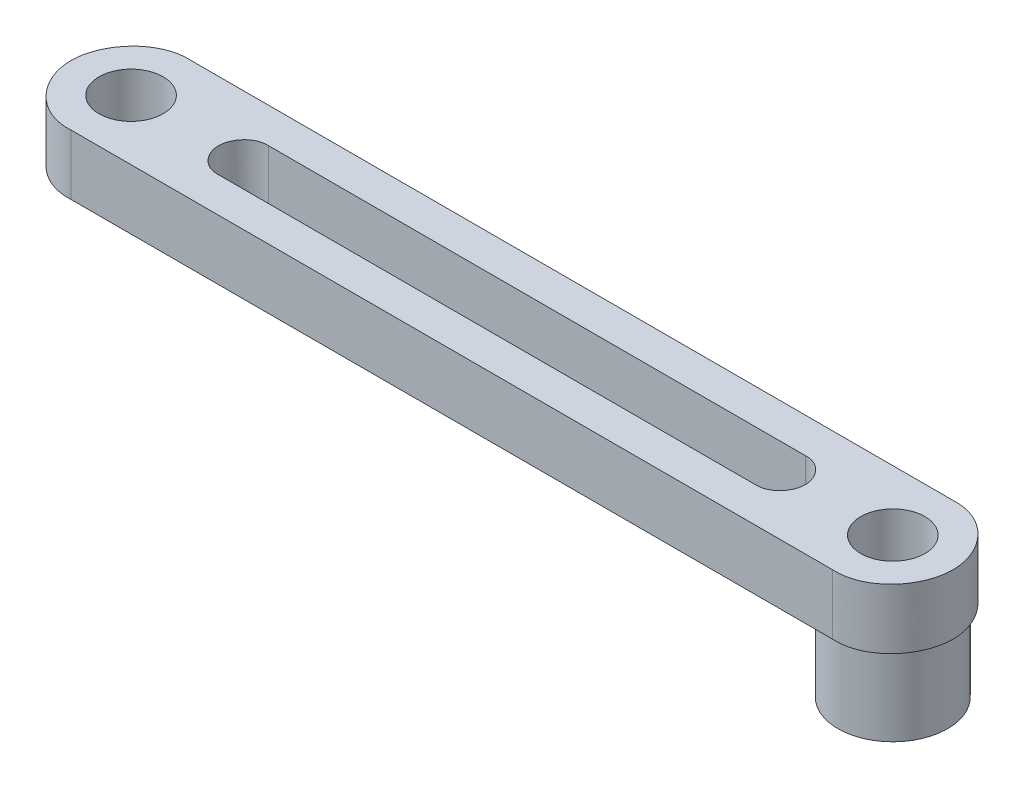
from build123d import *

# Parameters (mm, degrees)
ESQUISSE1_R             = 1.6
BOSS_EXTRU_1_DEPTH      = 3
BOSS_EXTRU_2_START      = 4
ESQUISSE2_R             = 2.734743529
ESQUISSE2_R_2           = 1.6
BOSS_EXTRU_2_DEPTH      = 4
ENL_V_MAT_EXTRU_1_DEPTH = 3


with BuildPart() as part:
    # Esquisse1 → Boss.-Extru.1 (new body)
    with BuildSketch(Plane(origin=(0, 0, 0), x_dir=(1, 0, 0), z_dir=(0, 1, 0))):
        with BuildLine():
            Line((-19, 3), (19, 3))
            add(Edge.make_bspline(
                [(19, 3), (20.68639149, 3.094620003), (23.315621509, 0.000753175), (20.682364624, -3.097569459), (19, -3)],
                knots=[0, 0, 0, 0, 0.499941737, 1, 1, 1, 1], degree=3))
            Line((19, -3), (-19, -3))
            add(Edge.make_bspline(
                [(-19, 3), (-20.661097815, 3.102497637), (-23.341647105, 0.00157467), (-20.655607875, -3.105760191), (-19, -3)],
                knots=[0, 0, 0, 0, 0.499995441, 1, 1, 1, 1], degree=3))
        make_face()
        with Locations(Location((-19, 0, 0), (0, 0, 270))):
            Circle(ESQUISSE1_R, mode=Mode.SUBTRACT)
        with Locations(Location((19, 0, 0), (0, 0, 90))):
            Circle(ESQUISSE1_R, mode=Mode.SUBTRACT)
    extrude(amount=BOSS_EXTRU_1_DEPTH)

    # Esquisse2 → Boss.-Extru.2 (add)
    with BuildSketch(Plane.XZ.offset(BOSS_EXTRU_2_START)):
        with Locations(Location((19, 0, 0), (0, 0, 270))):
            Circle(ESQUISSE2_R)
        with Locations(Location((19, 0, 0), (0, 0, 270))):
            Circle(ESQUISSE2_R_2, mode=Mode.SUBTRACT)
    extrude(amount=-BOSS_EXTRU_2_DEPTH)

    # Esquisse3 → Enlèv. mat.-Extru.1 (cut)
    with BuildSketch(Plane(origin=(0, 3, 0), x_dir=(1, 0, 0), z_dir=(0, 1, 0))):
        with BuildLine():
            Line((13.390376778, -1.25), (-13.390376778, -1.25))
            add(Edge.make_bspline(
                [(-13.390376778, -1.25), (-14.091002552, -1.290578927), (-15.1894504, 0.000117245), (-14.091603718, 1.290145329), (-13.390376778, 1.25)],
                knots=[0, 0, 0, 0, 0.500019288, 1, 1, 1, 1], degree=3))
            Line((-13.390376778, 1.25), (13.390376778, 1.25))
            add(Edge.make_bspline(
                [(13.390376778, -1.25), (14.084933338, -1.288382663), (15.205457343, -0.00659589), (14.065682357, 1.298551464), (13.390376778, 1.25)],
                knots=[0, 0, 0, 0, 0.500292138, 1, 1, 1, 1], degree=3))
        make_face()
    extrude(amount=-ENL_V_MAT_EXTRU_1_DEPTH, mode=Mode.SUBTRACT)


solid = part.part
